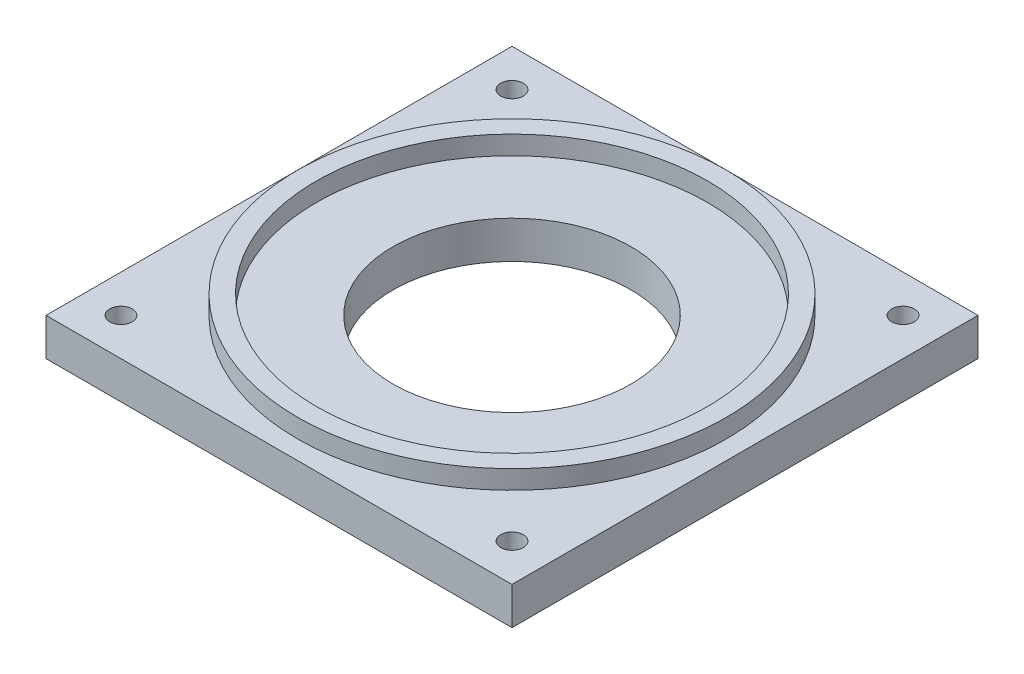
from build123d import *

# Parameters (mm, degrees)
SKETCH1_W           = 62.15
SKETCH1_H           = 62.15
BOSS_EXTRUDE1_DEPTH = 5
CUT_EXTRUDE1_REACH  = 46.23
SKETCH2_R           = 1.5
SKETCH3_R           = 28.575
SKETCH3_R_2         = 26.075
BOSS_EXTRUDE2_DEPTH = 2.5
CUT_EXTRUDE2_REACH  = 46.23
SKETCH4_R           = 15.875
SKETCH5_R           = 3
CUT_EXTRUDE3_DEPTH  = 2


with BuildPart() as part:
    # Sketch1 → Boss-Extrude1 (new body)
    with BuildSketch(Plane(origin=(0, 0, 0), x_dir=(1, 0, 0), z_dir=(0, 1, 0))):
        Rectangle(SKETCH1_W, SKETCH1_H)
    extrude(amount=BOSS_EXTRUDE1_DEPTH)

    # Sketch2 → Cut-Extrude1 (cut, up to next)
    with BuildSketch(Plane(origin=(0, 5, 0), x_dir=(1, 0, 0), z_dir=(0, 1, 0)), mode=Mode.PRIVATE) as cut_extrude1_sk1:
        with Locations(Location((-26.075, 26.075, 0), (0, 0, 270))):
            Circle(SKETCH2_R)
    cut_extrude1_tool1 = extrude(cut_extrude1_sk1.sketch, amount=-CUT_EXTRUDE1_REACH, mode=Mode.PRIVATE) & part.part
    # Sketch2 → Cut-Extrude1 (cut, up to next)
    with BuildSketch(Plane(origin=(0, 5, 0), x_dir=(1, 0, 0), z_dir=(0, 1, 0)), mode=Mode.PRIVATE) as cut_extrude1_sk2:
        with Locations(Location((-26.075, -26.075, 0), (0, 0, 270))):
            Circle(SKETCH2_R)
    cut_extrude1_tool2 = extrude(cut_extrude1_sk2.sketch, amount=-CUT_EXTRUDE1_REACH, mode=Mode.PRIVATE) & part.part
    # Sketch2 → Cut-Extrude1 (cut, up to next)
    with BuildSketch(Plane(origin=(0, 5, 0), x_dir=(1, 0, 0), z_dir=(0, 1, 0)), mode=Mode.PRIVATE) as cut_extrude1_sk3:
        with Locations(Location((26.075, -26.075, 0), (0, 0, 270))):
            Circle(SKETCH2_R)
    cut_extrude1_tool3 = extrude(cut_extrude1_sk3.sketch, amount=-CUT_EXTRUDE1_REACH, mode=Mode.PRIVATE) & part.part
    # Sketch2 → Cut-Extrude1 (cut, up to next)
    with BuildSketch(Plane(origin=(0, 5, 0), x_dir=(1, 0, 0), z_dir=(0, 1, 0)), mode=Mode.PRIVATE) as cut_extrude1_sk4:
        with Locations(Location((26.075, 26.075, 0), (0, 0, 270))):
            Circle(SKETCH2_R)
    cut_extrude1_tool4 = extrude(cut_extrude1_sk4.sketch, amount=-CUT_EXTRUDE1_REACH, mode=Mode.PRIVATE) & part.part
    add(cut_extrude1_tool1.solids().sort_by_distance((-26.075, 5, -26.075))[0], mode=Mode.SUBTRACT)
    add(cut_extrude1_tool2.solids().sort_by_distance((-26.075, 5, 26.075))[0], mode=Mode.SUBTRACT)
    add(cut_extrude1_tool3.solids().sort_by_distance((26.075, 5, 26.075))[0], mode=Mode.SUBTRACT)
    add(cut_extrude1_tool4.solids().sort_by_distance((26.075, 5, -26.075))[0], mode=Mode.SUBTRACT)

    # Sketch3 → Boss-Extrude2 (add)
    with BuildSketch(Plane(origin=(0, 5, 0), x_dir=(1, 0, 0), z_dir=(0, 1, 0))):
        with Locations(Location((0, 0, 0), (0, 0, 270))):
            Circle(SKETCH3_R)
        with Locations(Location((0, 0, 0), (0, 0, 270))):
            Circle(SKETCH3_R_2, mode=Mode.SUBTRACT)
    extrude(amount=BOSS_EXTRUDE2_DEPTH)

    # Sketch4 → Cut-Extrude2 (cut, up to next)
    with BuildSketch(Plane(origin=(0, 5, 0), x_dir=(1, 0, 0), z_dir=(0, 1, 0)), mode=Mode.PRIVATE) as cut_extrude2_sk1:
        with Locations(Location((0, 0, 0), (0, 0, 270))):
            Circle(SKETCH4_R)
    cut_extrude2_tool1 = extrude(cut_extrude2_sk1.sketch, amount=-CUT_EXTRUDE2_REACH, mode=Mode.PRIVATE) & part.part
    add(cut_extrude2_tool1.solids().sort_by_distance((0, 5, 0))[0], mode=Mode.SUBTRACT)

    # Sketch5 → Cut-Extrude3 (cut)
    with BuildSketch(Plane.XZ):
        with Locations(Location((-26.075, 26.075, 0), (0, 0, 270))):
            Circle(SKETCH5_R)
        with Locations(Location((-26.075, -26.075, 0), (0, 0, 90))):
            Circle(SKETCH5_R)
        with Locations(Location((26.075, -26.075, 0), (0, 0, 270))):
            Circle(SKETCH5_R)
        with Locations(Location((26.075, 26.075, 0), (0, 0, 90))):
            Circle(SKETCH5_R)
    extrude(amount=-CUT_EXTRUDE3_DEPTH, mode=Mode.SUBTRACT)


solid = part.part
